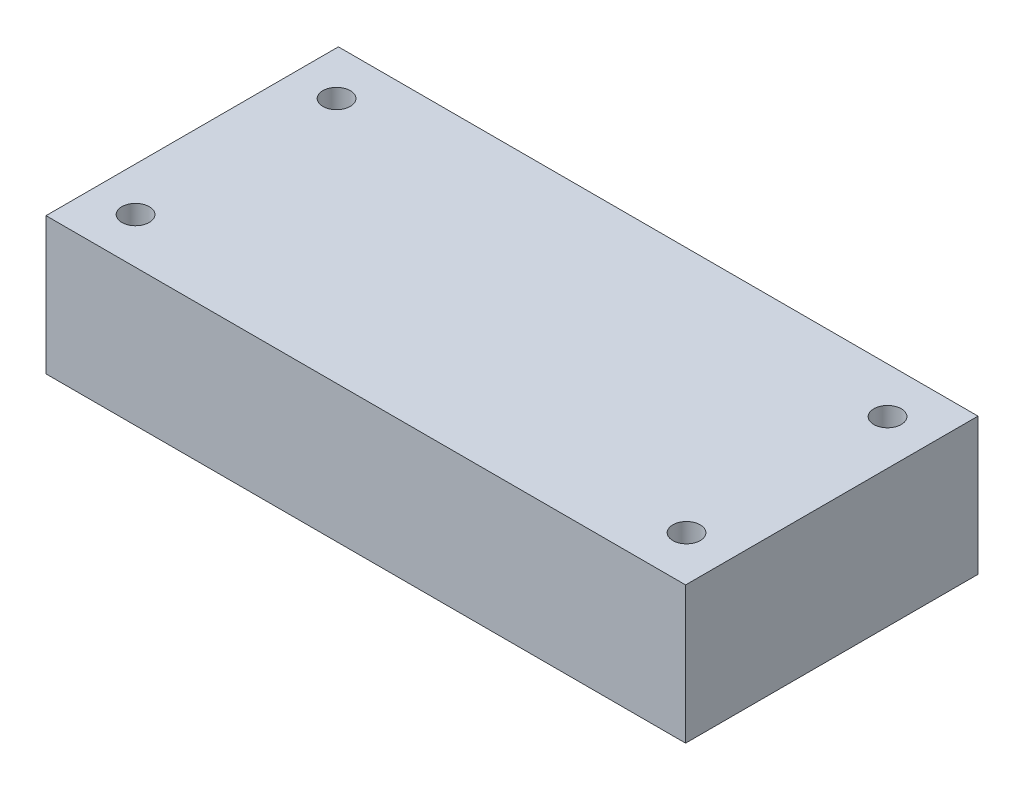
from build123d import *

# Parameters (mm, degrees)
SKETCH1_W           = 70
SKETCH1_H           = 32
SKETCH1_R           = 1.5
BOSS_EXTRUDE1_DEPTH = 15


with BuildPart() as part:
    # Sketch1 → Boss-Extrude1 (new body)
    with BuildSketch(Plane(origin=(0, 0, 0), x_dir=(1, 0, 0), z_dir=(0, 1, 0))):
        Rectangle(SKETCH1_W, SKETCH1_H)
        with Locations(Location((-30.2, 11, 0), (0, 0, 270))):
            Circle(SKETCH1_R, mode=Mode.SUBTRACT)
        with Locations(Location((30.1, 11, 0), (0, 0, 270))):
            Circle(SKETCH1_R, mode=Mode.SUBTRACT)
        with Locations(Location((30.1, -11, 0), (0, 0, 270))):
            Circle(SKETCH1_R, mode=Mode.SUBTRACT)
        with Locations(Location((-30.2, -11, 0), (0, 0, 270))):
            Circle(SKETCH1_R, mode=Mode.SUBTRACT)
    extrude(amount=BOSS_EXTRUDE1_DEPTH)


solid = part.part
